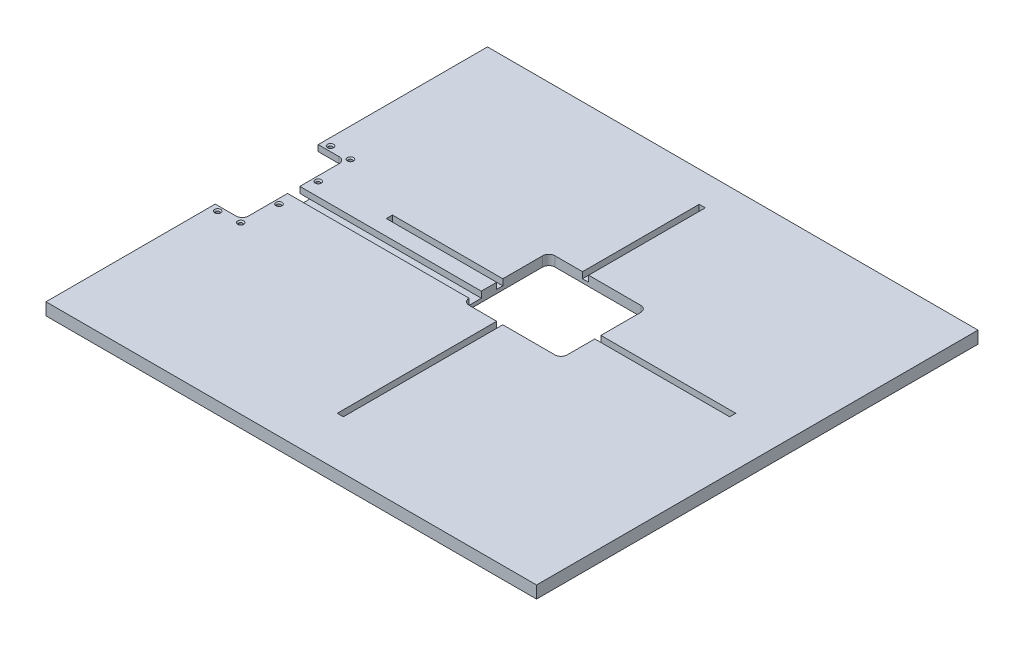
from build123d import *

# Parameters (mm, degrees)
SKETCH1_W           = 400
SKETCH1_H           = 360
BOSS_EXTRUDE1_DEPTH = 10
CUT_EXTRUDE1_DEPTH  = 285.429253067
CUT_EXTRUDE2_DEPTH  = 2
SKETCH5_R           = 1.5
CUT_EXTRUDE3_DEPTH  = 3
CUT_EXTRUDE6_DEPTH  = 5
CUT_EXTRUDE7_DEPTH  = 5
SKETCH11_R          = 1.5
CUT_EXTRUDE8_DEPTH  = 285.297379517
SKETCH14_W          = 160
SKETCH14_H          = 10
CUT_EXTRUDE9_DEPTH  = 5
SKETCH15_W          = 5
SKETCH15_H          = 295.150358454
SKETCH15_W_2        = 280
SKETCH15_H_2        = 5
CUT_EXTRUDE10_DEPTH = 5
CHAMFER2_SIZE       = 1


with BuildPart() as part:
    # Sketch1 → Boss-Extrude1 (new body)
    with BuildSketch(Plane(origin=(0, 0, 0), x_dir=(1, 0, 0), z_dir=(0, 1, 0))):
        with Locations((-20, 0)):
            Rectangle(SKETCH1_W, SKETCH1_H)
    extrude(amount=-BOSS_EXTRUDE1_DEPTH)

    # Sketch3 → Cut-Extrude1 (cut, through all)
    with BuildSketch(Plane(origin=(0, 0, 0), x_dir=(1, 0, 0), z_dir=(0, 1, 0))):
        with BuildLine():
            Line((-45, 60), (25, 60))
            ThreePointArc((25, 60), (28.535533906, 58.535533906), (30, 55))
            Line((30, 55), (30, -5))
            ThreePointArc((30, -5), (28.535533906, -8.535533906), (25, -10))
            Line((25, -10), (-45, -10))
            ThreePointArc((-45, -10), (-48.535533906, -8.535533906), (-50, -5))
            Line((-50, -5), (-50, 55))
            ThreePointArc((-50, 55), (-48.535533906, 58.535533906), (-45, 60))
        make_face()
    extrude(amount=-CUT_EXTRUDE1_DEPTH, mode=Mode.SUBTRACT)

    # Sketch4 → Cut-Extrude2 (cut)
    with BuildSketch(Plane.XZ.offset(10)):
        with BuildLine():
            Line((-52, 18), (32, 18))
            ThreePointArc((32, 18), (36.242640687, 16.242640687), (38, 12))
            Line((38, 12), (38, -62))
            ThreePointArc((38, -62), (36.242640687, -66.242640687), (32, -68))
            Line((32, -68), (-52, -68))
            ThreePointArc((-52, -68), (-56.242640687, -66.242640687), (-58, -62))
            Line((-58, -62), (-58, 12))
            ThreePointArc((-58, 12), (-56.242640687, 16.242640687), (-52, 18))
        make_face()
    extrude(amount=-CUT_EXTRUDE2_DEPTH, mode=Mode.SUBTRACT)

    # Sketch5 → Cut-Extrude3 (cut)
    with BuildSketch(Plane.XZ.offset(8)):
        with Locations(Location((32, 12, 0), (0, 0, 270))):
            Circle(SKETCH5_R)
        with Locations(Location((-52, 12, 0), (0, 0, 270))):
            Circle(SKETCH5_R)
        with Locations(Location((32, -62, 0), (0, 0, 270))):
            Circle(SKETCH5_R)
        with Locations(Location((-52, -62, 0), (0, 0, 270))):
            Circle(SKETCH5_R)
    extrude(amount=-CUT_EXTRUDE3_DEPTH, mode=Mode.SUBTRACT)

    # Sketch9 → Cut-Extrude6 (cut)
    with BuildSketch(Plane(origin=(0, -10, 0), x_dir=(1, 0, 0), z_dir=(0, 1, 0))):
        with BuildLine():
            Line((-220, 50), (-195, 50))
            ThreePointArc((-195, 50), (-191.464466094, 48.535533906), (-190, 45))
            Line((-190, 45), (-190, -45))
            ThreePointArc((-190, -45), (-191.464466094, -48.535533906), (-195, -50))
            Line((-195, -50), (-220, -50))
            Line((-220, -50), (-220, 50))
        make_face()
    extrude(amount=CUT_EXTRUDE6_DEPTH, mode=Mode.SUBTRACT)

    # Sketch10 → Cut-Extrude7 (cut)
    with BuildSketch(Plane(origin=(0, -5, 0), x_dir=(-1, 0, 0), z_dir=(0, -1, 0))):
        with BuildLine():
            Line((220, 42), (220, -42))
            Line((220, -42), (203, -42))
            ThreePointArc((203, -42), (199.464466094, -40.535533906), (198, -37))
            Line((198, -37), (198, 37))
            ThreePointArc((198, 37), (199.464466094, 40.535533906), (203, 42))
            Line((203, 42), (220, 42))
        make_face()
    extrude(amount=-CUT_EXTRUDE7_DEPTH, mode=Mode.SUBTRACT)

    # Sketch11 → Cut-Extrude8 (cut, through all)
    with BuildSketch(Plane(origin=(0, -5, 0), x_dir=(-1, 0, 0), z_dir=(0, -1, 0))):
        with Locations(Location((214, 46, 0), (0, 0, 90))):
            Circle(SKETCH11_R)
        with Locations(Location((194, 16, 0), (0, 0, 90))):
            Circle(SKETCH11_R)
        with Locations(Location((196.5, 44.75, 0), (0, 0, 90))):
            Circle(SKETCH11_R)
        with Locations(Location((196.5, -44.75, 0), (0, 0, 270))):
            Circle(SKETCH11_R)
        with Locations(Location((194, -16, 0), (0, 0, 270))):
            Circle(SKETCH11_R)
        with Locations(Location((214, -46, 0), (0, 0, 270))):
            Circle(SKETCH11_R)
    extrude(amount=-CUT_EXTRUDE8_DEPTH, mode=Mode.SUBTRACT)

    # Sketch14 → Cut-Extrude9 (cut)
    with BuildSketch(Plane(origin=(0, 0, 0), x_dir=(1, 0, 0), z_dir=(0, 1, 0))):
        with Locations((-118, 0)):
            Rectangle(SKETCH14_W, SKETCH14_H)
    extrude(amount=-CUT_EXTRUDE9_DEPTH, mode=Mode.SUBTRACT)

    # Sketch15 → Cut-Extrude10 (cut)
    with BuildSketch(Plane(origin=(0, 0, 0), x_dir=(1, 0, 0), z_dir=(0, 1, 0))):
        with Locations((-20, 7.575179227)):
            Rectangle(SKETCH15_W, SKETCH15_H)
        with Locations((0, 20)):
            Rectangle(SKETCH15_W_2, SKETCH15_H_2)
    extrude(amount=-CUT_EXTRUDE10_DEPTH, mode=Mode.SUBTRACT)

    # Chamfer2
    chamfer2_edges = [part.edges().sort_by_distance(p)[0] for p in [
        (-214, 0, 44.5),
        (-194, 0, 14.5),
        (-196.5, 0, 43.25),
        (-196.5, 0, -43.25),
        (-194, 0, -14.5),
        (-214, 0, -44.5),
    ]]
    chamfer(chamfer2_edges, length=CHAMFER2_SIZE)


solid = part.part
